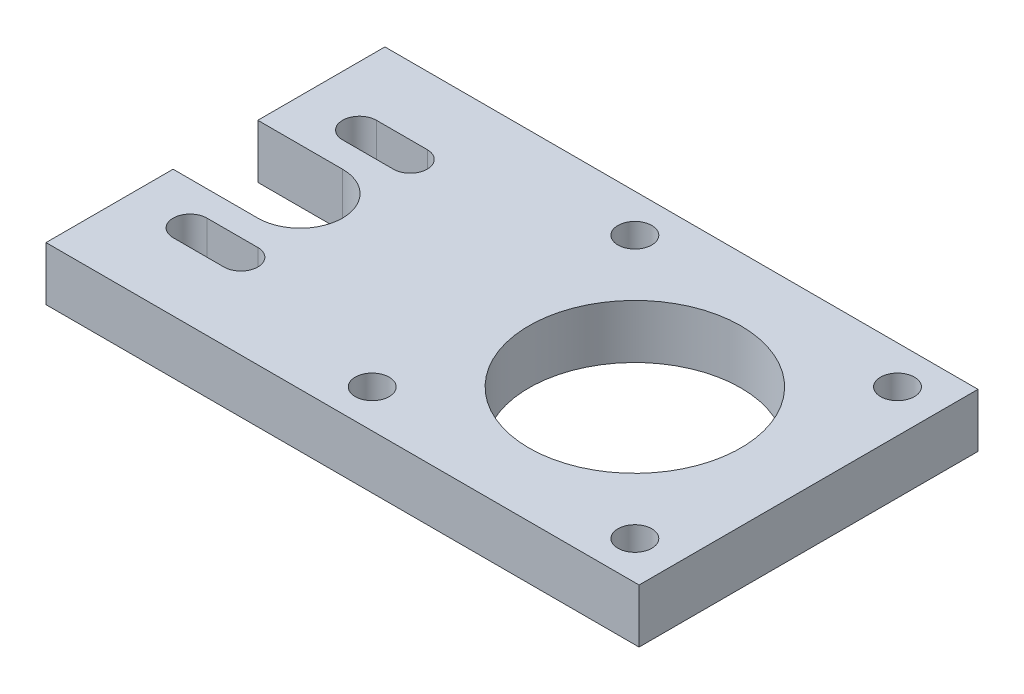
from build123d import *

# Parameters (mm, degrees)
SKETCH1_W           = 70
SKETCH1_H           = 40
BOSS_EXTRUDE1_DEPTH = 6.35
SKETCH2_R           = 12.5
SKETCH2_R_2         = 2
CUT_EXTRUDE1_DEPTH  = 81.872260386


with BuildPart() as part:
    # Sketch1 → Boss-Extrude1 (new body)
    with BuildSketch(Plane(origin=(0, 0, 0), x_dir=(1, 0, 0), z_dir=(0, 1, 0))):
        with Locations((35, 20)):
            Rectangle(SKETCH1_W, SKETCH1_H)
    extrude(amount=BOSS_EXTRUDE1_DEPTH)

    # Sketch2 → Cut-Extrude1 (cut, through all)
    with BuildSketch(Plane(origin=(0, 6.35, 0), x_dir=(1, 0, 0), z_dir=(0, 1, 0))):
        with Locations(Location((49.5, 20, 0), (0, 0, 270))):
            Circle(SKETCH2_R)
        with Locations(Location((34, 35.5, 0), (0, 0, 270))):
            Circle(SKETCH2_R_2)
        with Locations(Location((65, 35.5, 0), (0, 0, 270))):
            Circle(SKETCH2_R_2)
        with Locations(Location((65, 4.5, 0), (0, 0, 270))):
            Circle(SKETCH2_R_2)
        with Locations(Location((34, 4.5, 0), (0, 0, 270))):
            Circle(SKETCH2_R_2)
        with BuildLine():
            Line((10, 25), (0, 25))
            Line((0, 25), (0, 15))
            Line((0, 15), (10, 15))
            ThreePointArc((10, 15), (15, 20), (10, 25))
        make_face()
        with BuildLine():
            Line((13, 28), (7, 28))
            ThreePointArc((7, 28), (5, 30), (7, 32))
            Line((7, 32), (13, 32))
            ThreePointArc((13, 32), (15, 30), (13, 28))
        make_face()
        with BuildLine():
            Line((7, 12), (13, 12))
            ThreePointArc((13, 12), (15, 10), (13, 8))
            Line((13, 8), (7, 8))
            ThreePointArc((7, 8), (5, 10), (7, 12))
        make_face()
    extrude(amount=-CUT_EXTRUDE1_DEPTH, mode=Mode.SUBTRACT)


solid = part.part
